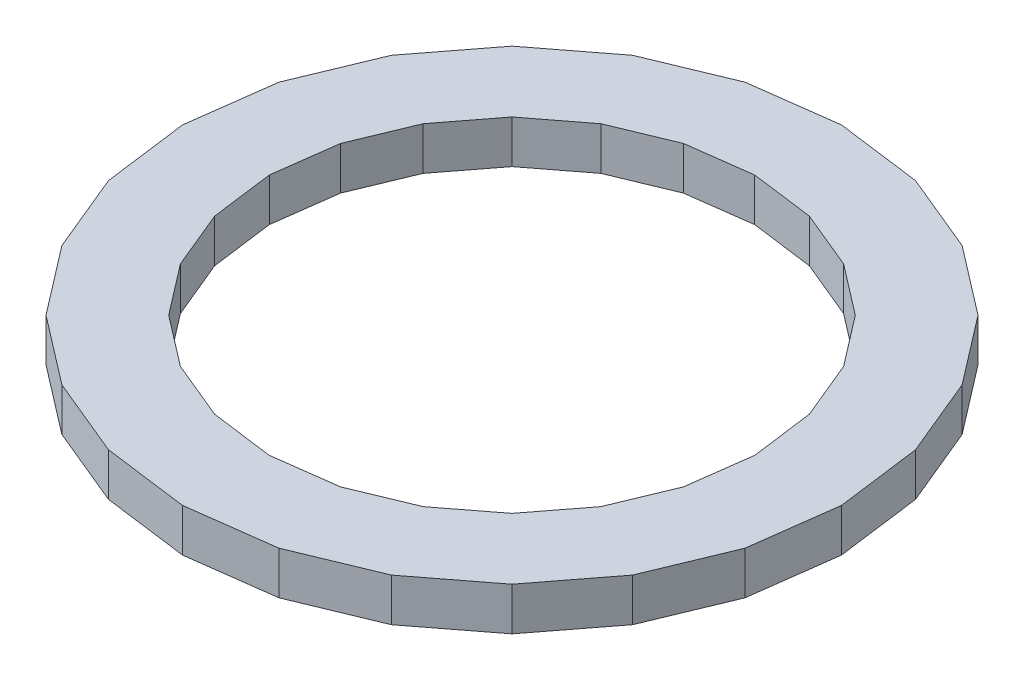
from build123d import *

# Parameters (mm, degrees)
BOSS_EXTRUDE3_DEPTH = 19.05


with BuildPart() as part:
    # Sketch3 → Boss-Extrude3 (new body)
    with BuildSketch(Plane(origin=(0, 0, 0), x_dir=(1, 0, 0), z_dir=(0, 1, 0))):
        Polygon((-145.947718814, 0), (-140.97467089, -37.774049218), (-126.394432117, -72.973859407), (-103.200621672, -103.200621672), (-72.973859407, -126.394432117), (-37.774049218, -140.97467089), (0, -145.947718814), (37.774049218, -140.97467089), (72.973859407, -126.394432117), (103.200621672, -103.200621672), (126.394432117, -72.973859407), (140.97467089, -37.774049218), (145.947718814, 0), (140.97467089, 37.774049218), (126.394432117, 72.973859407), (103.200621672, 103.200621672), (72.973859407, 126.394432117), (37.774049218, 140.97467089), (0, 145.947718814), (-37.774049218, 140.97467089), (-72.973859407, 126.394432117), (-103.200621672, 103.200621672), (-126.394432117, 72.973859407), (-140.97467089, 37.774049218), align=None)
        Polygon((-107.518955416, 0), (-103.855335852, -27.827953371), (-93.114146779, -53.759477708), (-76.027382481, -76.027382481), (-53.759477708, -93.114146779), (-27.827953371, -103.855335852), (0, -107.518955416), (27.827953371, -103.855335852), (53.759477708, -93.114146779), (76.027382481, -76.027382481), (93.114146779, -53.759477708), (103.855335852, -27.827953371), (107.518955416, 0), (103.855335852, 27.827953371), (93.114146779, 53.759477708), (76.027382481, 76.027382481), (53.759477708, 93.114146779), (27.827953371, 103.855335852), (0, 107.518955416), (-27.827953371, 103.855335852), (-53.759477708, 93.114146779), (-76.027382481, 76.027382481), (-93.114146779, 53.759477708), (-103.855335852, 27.827953371), align=None, mode=Mode.SUBTRACT)
    extrude(amount=BOSS_EXTRUDE3_DEPTH)


solid = part.part
